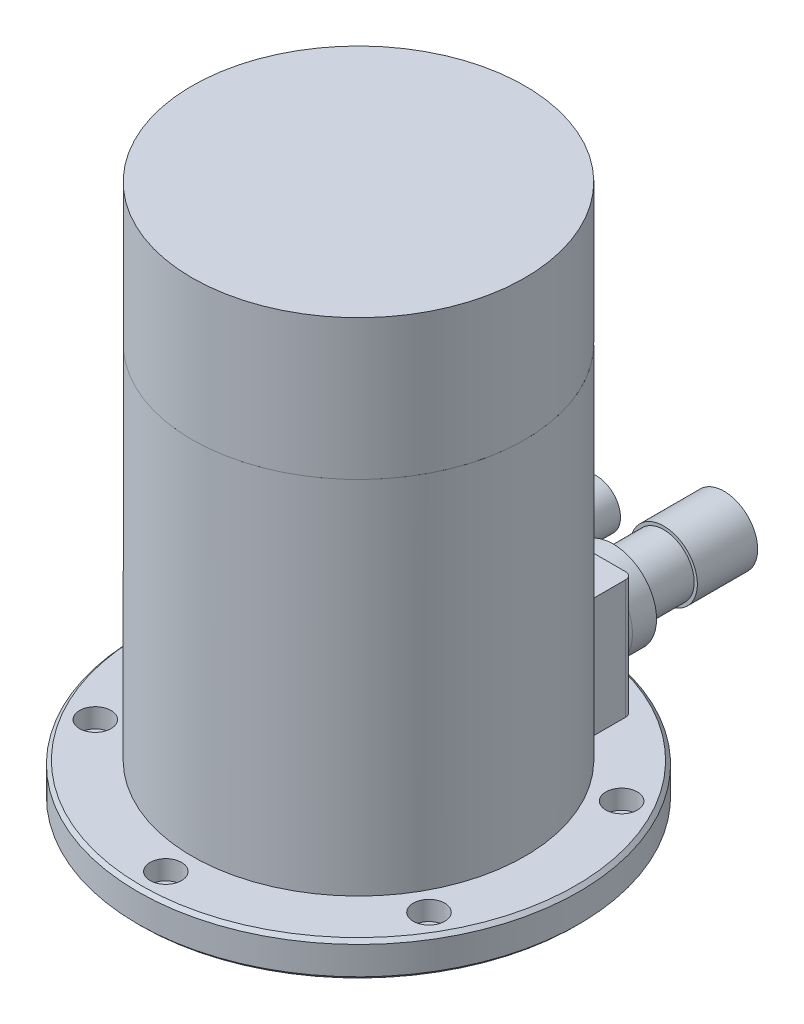
from build123d import *

# Parameters (mm, degrees)
SKETCH1_R                = 63
BOSS_EXTRUDE1_DEPTH      = 10
CHAMFER1_SIZE            = 1
SKETCH2_R                = 47.5
BOSS_EXTRUDE2_DEPTH      = 103
CUT_EXTRUDE1_REACH       = 138.187
SKETCH3_R                = 2.75
SKETCH4_R                = 4.5
CUT_EXTRUDE2_DEPTH       = 5.5
SKETCH5_R                = 46.2
CUT_EXTRUDE3_DEPTH       = 1
SKETCH6_R                = 47.5
BOSS_EXTRUDE3_DEPTH      = 40
BOSS_EXTRUDE4_REACH      = 202.791
BOSS_EXTRUDE4_END_RADIUS = 47.5
SKETCH7_W                = 55
SKETCH7_H                = 34
FILLET1_R                = 2
SKETCH8_R                = 12.6
BOSS_EXTRUDE5_DEPTH      = 2.63
SKETCH9_R                = 12.39
BOSS_EXTRUDE6_DEPTH      = 7.07
SKETCH10_R               = 8.68
BOSS_EXTRUDE7_DEPTH      = 14.45
SKETCH11_R               = 9.59
BOSS_EXTRUDE8_DEPTH      = 17.22
SKETCH12_R               = 9
BOSS_EXTRUDE9_DEPTH      = 6.2
SKETCH13_R               = 6.2
BOSS_EXTRUDE10_DEPTH     = 11.2
SKETCH14_R               = 6.85
BOSS_EXTRUDE11_DEPTH     = 12.3


with BuildPart() as part:
    # Sketch1 → Boss-Extrude1 (new body)
    with BuildSketch(Plane(origin=(0, 0, 0), x_dir=(1, 0, 0), z_dir=(0, 1, 0))):
        with Locations(Location((0, 0, 0), (0, 0, 270))):
            Circle(SKETCH1_R)
    extrude(amount=BOSS_EXTRUDE1_DEPTH)

    # Chamfer1
    chamfer1_edges = [part.edges().sort_by_distance(p)[0] for p in [
        (0, 0, -63),
        (0, 10, -63),
    ]]
    chamfer(chamfer1_edges, length=CHAMFER1_SIZE)

    # Sketch2 → Boss-Extrude2 (add)
    with BuildSketch(Plane(origin=(0, 10, 0), x_dir=(1, 0, 0), z_dir=(0, 1, 0))):
        with Locations(Location((0, 0, 0), (0, 0, 270))):
            Circle(SKETCH2_R)
    extrude(amount=BOSS_EXTRUDE2_DEPTH)

    # Sketch3 → Cut-Extrude1 (cut, up to next)
    with BuildSketch(Plane(origin=(0, 10, 0), x_dir=(1, 0, 0), z_dir=(0, 1, 0)), mode=Mode.PRIVATE) as cut_extrude1_sk1:
        with Locations(Location((0, 55, 0), (0, 0, 270))):
            Circle(SKETCH3_R)
    cut_extrude1_tool1 = extrude(cut_extrude1_sk1.sketch, amount=-CUT_EXTRUDE1_REACH, mode=Mode.PRIVATE) & part.part
    # Sketch3 → Cut-Extrude1 (cut, up to next)
    with BuildSketch(Plane(origin=(0, 10, 0), x_dir=(1, 0, 0), z_dir=(0, 1, 0)), mode=Mode.PRIVATE) as cut_extrude1_sk2:
        with Locations(Location((47.631397208, 27.5, 0), (0, 0, 270))):
            Circle(SKETCH3_R)
    cut_extrude1_tool2 = extrude(cut_extrude1_sk2.sketch, amount=-CUT_EXTRUDE1_REACH, mode=Mode.PRIVATE) & part.part
    # Sketch3 → Cut-Extrude1 (cut, up to next)
    with BuildSketch(Plane(origin=(0, 10, 0), x_dir=(1, 0, 0), z_dir=(0, 1, 0)), mode=Mode.PRIVATE) as cut_extrude1_sk3:
        with Locations(Location((47.631397208, -27.5, 0), (0, 0, 270))):
            Circle(SKETCH3_R)
    cut_extrude1_tool3 = extrude(cut_extrude1_sk3.sketch, amount=-CUT_EXTRUDE1_REACH, mode=Mode.PRIVATE) & part.part
    # Sketch3 → Cut-Extrude1 (cut, up to next)
    with BuildSketch(Plane(origin=(0, 10, 0), x_dir=(1, 0, 0), z_dir=(0, 1, 0)), mode=Mode.PRIVATE) as cut_extrude1_sk4:
        with Locations(Location((0, -55, 0), (0, 0, 270))):
            Circle(SKETCH3_R)
    cut_extrude1_tool4 = extrude(cut_extrude1_sk4.sketch, amount=-CUT_EXTRUDE1_REACH, mode=Mode.PRIVATE) & part.part
    # Sketch3 → Cut-Extrude1 (cut, up to next)
    with BuildSketch(Plane(origin=(0, 10, 0), x_dir=(1, 0, 0), z_dir=(0, 1, 0)), mode=Mode.PRIVATE) as cut_extrude1_sk5:
        with Locations(Location((-47.631397208, -27.5, 0), (0, 0, 270))):
            Circle(SKETCH3_R)
    cut_extrude1_tool5 = extrude(cut_extrude1_sk5.sketch, amount=-CUT_EXTRUDE1_REACH, mode=Mode.PRIVATE) & part.part
    # Sketch3 → Cut-Extrude1 (cut, up to next)
    with BuildSketch(Plane(origin=(0, 10, 0), x_dir=(1, 0, 0), z_dir=(0, 1, 0)), mode=Mode.PRIVATE) as cut_extrude1_sk6:
        with Locations(Location((-47.631397208, 27.5, 0), (0, 0, 270))):
            Circle(SKETCH3_R)
    cut_extrude1_tool6 = extrude(cut_extrude1_sk6.sketch, amount=-CUT_EXTRUDE1_REACH, mode=Mode.PRIVATE) & part.part
    add(cut_extrude1_tool1.solids().sort_by_distance((0, 10, -55))[0], mode=Mode.SUBTRACT)
    add(cut_extrude1_tool2.solids().sort_by_distance((47.631397, 10, -27.5))[0], mode=Mode.SUBTRACT)
    add(cut_extrude1_tool3.solids().sort_by_distance((47.631397, 10, 27.5))[0], mode=Mode.SUBTRACT)
    add(cut_extrude1_tool4.solids().sort_by_distance((0, 10, 55))[0], mode=Mode.SUBTRACT)
    add(cut_extrude1_tool5.solids().sort_by_distance((-47.631397, 10, 27.5))[0], mode=Mode.SUBTRACT)
    add(cut_extrude1_tool6.solids().sort_by_distance((-47.631397, 10, -27.5))[0], mode=Mode.SUBTRACT)

    # Sketch4 → Cut-Extrude2 (cut)
    with BuildSketch(Plane(origin=(0, 10, 0), x_dir=(1, 0, 0), z_dir=(0, 1, 0))):
        with Locations(Location((0, 55, 0), (0, 0, 270))):
            Circle(SKETCH4_R)
        with Locations(Location((47.631397208, 27.5, 0), (0, 0, 270))):
            Circle(SKETCH4_R)
        with Locations(Location((47.631397208, -27.5, 0), (0, 0, 270))):
            Circle(SKETCH4_R)
        with Locations(Location((0, -55, 0), (0, 0, 270))):
            Circle(SKETCH4_R)
        with Locations(Location((-47.631397208, -27.5, 0), (0, 0, 270))):
            Circle(SKETCH4_R)
        with Locations(Location((-47.631397208, 27.5, 0), (0, 0, 270))):
            Circle(SKETCH4_R)
    extrude(amount=-CUT_EXTRUDE2_DEPTH, mode=Mode.SUBTRACT)

    # Sketch5 → Cut-Extrude3 (cut)
    with BuildSketch(Plane.XZ):
        with Locations(Location((0, 0, 0), (0, 0, 270))):
            Circle(SKETCH5_R)
    extrude(amount=-CUT_EXTRUDE3_DEPTH, mode=Mode.SUBTRACT)

    # Boss-Extrude4: up to this cylinder (the profile starts outside it)
    boss_extrude4_end = Plane(origin=(0, 27, 0), z_dir=(0, -1, 0)) * Cylinder(BOSS_EXTRUDE4_END_RADIUS, 501.582, mode=Mode.PRIVATE)
    # Sketch7 → Boss-Extrude4 (add, up to the surface)
    with BuildSketch(Plane.XY.offset(-50.75), mode=Mode.PRIVATE) as boss_extrude4_sk1:
        with Locations((0, 27)):
            Rectangle(SKETCH7_W, SKETCH7_H)
    boss_extrude4_tool1 = extrude(boss_extrude4_sk1.sketch, amount=BOSS_EXTRUDE4_REACH, mode=Mode.PRIVATE) - boss_extrude4_end
    add(boss_extrude4_tool1.solids().sort_by_distance((0, 27, -50.75))[0])

    # Fillet1
    fillet1_edges = [part.edges().sort_by_distance(p)[0] for p in [
        (-27.5, 27, -50.75),
        (27.5, 27, -50.75),
    ]]
    fillet(fillet1_edges, radius=FILLET1_R)

    # Sketch8 → Boss-Extrude5 (add)
    with BuildSketch(Plane(origin=(0, 0, -50.75), x_dir=(-1, 0, 0), z_dir=(0, 0, -1))):
        with Locations((-12.25, 27)):
            Circle(SKETCH8_R)
    extrude(amount=BOSS_EXTRUDE5_DEPTH)

    # Sketch9 → Boss-Extrude6 (add)
    with BuildSketch(Plane(origin=(0, 0, -53.38), x_dir=(-1, 0, 0), z_dir=(0, 0, -1))):
        with Locations(Location((-12.25, 27, 0), (0, 0, 180))):
            Circle(SKETCH9_R)
    extrude(amount=BOSS_EXTRUDE6_DEPTH)

    # Sketch10 → Boss-Extrude7 (add)
    with BuildSketch(Plane(origin=(0, 0, -60.45), x_dir=(-1, 0, 0), z_dir=(0, 0, -1))):
        with Locations((-12.25, 27)):
            Circle(SKETCH10_R)
    extrude(amount=BOSS_EXTRUDE7_DEPTH)

    # Sketch11 → Boss-Extrude8 (add)
    with BuildSketch(Plane(origin=(0, 0, -74.9), x_dir=(-1, 0, 0), z_dir=(0, 0, -1))):
        with Locations((-12.25, 27)):
            Circle(SKETCH11_R)
    extrude(amount=BOSS_EXTRUDE8_DEPTH)

    # Sketch12 → Boss-Extrude9 (add)
    with BuildSketch(Plane(origin=(0, 0, -50.75), x_dir=(-1, 0, 0), z_dir=(0, 0, -1))):
        with Locations(Location((12.5, 27, 0), (0, 0, 180))):
            Circle(SKETCH12_R)
    extrude(amount=BOSS_EXTRUDE9_DEPTH)

    # Sketch13 → Boss-Extrude10 (add)
    with BuildSketch(Plane(origin=(0, 0, -56.95), x_dir=(-1, 0, 0), z_dir=(0, 0, -1))):
        with Locations((12.5, 27)):
            Circle(SKETCH13_R)
    extrude(amount=BOSS_EXTRUDE10_DEPTH)

    # Sketch14 → Boss-Extrude11 (add)
    with BuildSketch(Plane(origin=(0, 0, -68.15), x_dir=(-1, 0, 0), z_dir=(0, 0, -1))):
        with Locations((12.5, 27)):
            Circle(SKETCH14_R)
    extrude(amount=BOSS_EXTRUDE11_DEPTH)


with BuildPart() as body_2:
    # Sketch6 → Boss-Extrude3 (new body)
    with BuildSketch(Plane(origin=(0, 113, 0), x_dir=(1, 0, 0), z_dir=(0, 1, 0))):
        with Locations(Location((0, 0, 0), (0, 0, 270))):
            Circle(SKETCH6_R)
    extrude(amount=BOSS_EXTRUDE3_DEPTH)


solid = Compound([part.part, body_2.part])
